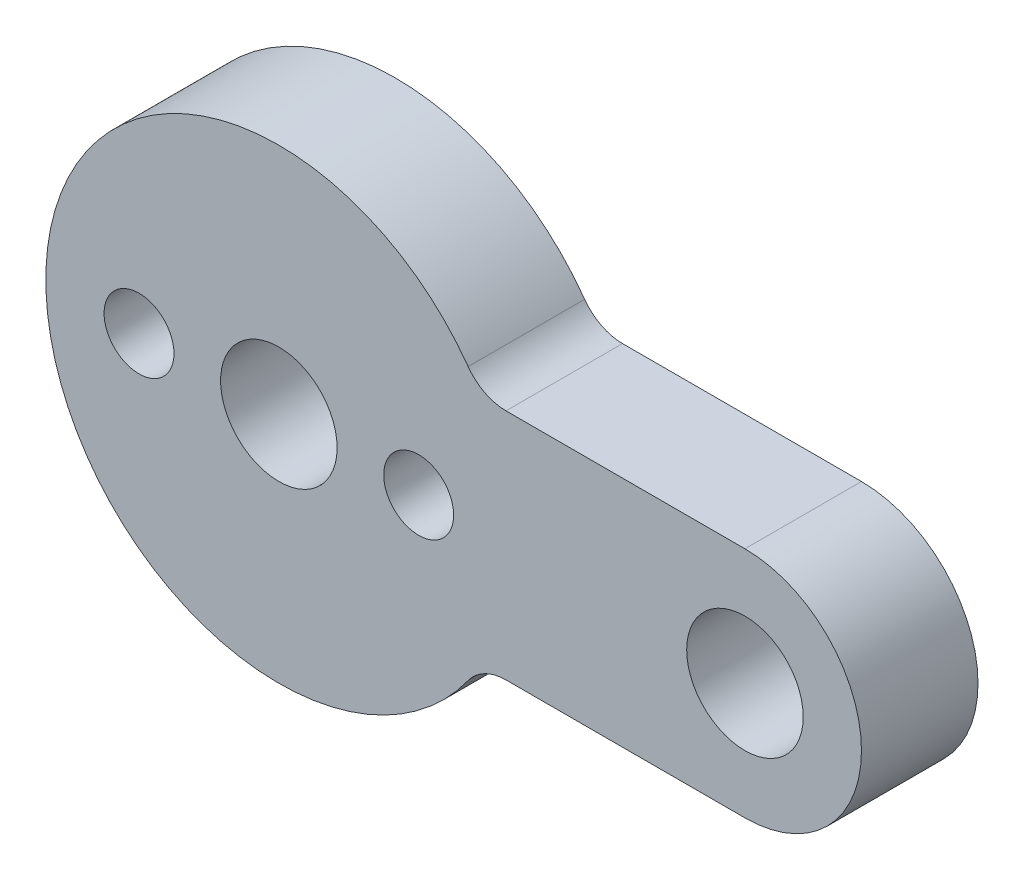
from build123d import *
from build123d.topology import SkipClean

# Parameters (mm, degrees)
SKETCH_1_R               = 2.4999999999999982
SKETCH_1_R_2             = 2.4999999999999947
SKETCH_1_R_3             = 2.5
EXTRUDE_1_DEPTH          = 5
EXTRUDE_START            = 12.8
SKETCH_2_R               = 5.000000000000004
SKETCH_2_R_2             = 2.4999999999999947
SKETCH_2_R_3             = 5
SKETCH_2_R_4             = 2.5
EXTRUDE_2_DEPTH          = 12.8
SKETCH_3_R               = 1.5000000000000007
CUT_EXTRUDE_1_DEPTH      = 13
EXTRUDE_START_2          = -5
EXTRUDE_3_DEPTH          = 5
FILLET_1_R               = 2
CUT_EXTRUDE_2_DEPTH      = 16
CUT_EXTRUDE_2_DEPTH_BACK = 10
CUT_EXTRUDE_START        = 14.000000000000002
SKETCH_7_R               = 5
CUT_EXTRUDE_3_DEPTH      = 14.000000000000002


with BuildPart() as part:
    # 草图1 → 凸台-拉伸1 (new body)
    with BuildSketch(Plane.XY):
        with BuildLine():
            Line((6.1e-16, -5), (-40, -5.000000000000006))
            ThreePointArc((-40, -5.000000000000006), (-45, -4.29e-15), (-40, 4.999999999999996))
            Line((-40, 4.999999999999996), (-6.1e-16, 5))
            ThreePointArc((-6.1e-16, 5), (5, 0), (6.1e-16, -5))
        make_face()
        with Locations((-20, -2.45e-15)):
            Circle(SKETCH_1_R, mode=Mode.SUBTRACT)
        with Locations((-40, -4.9e-15)):
            Circle(SKETCH_1_R_2, mode=Mode.SUBTRACT)
        Circle(SKETCH_1_R_3, mode=Mode.SUBTRACT)
    extrude(amount=EXTRUDE_1_DEPTH)

    # 草图2 → 凸台-拉伸2 (add)
    # profile 1 of 2: a face of its own
    with SkipClean():  # the faces are left unmerged after this step: merging them gives an invalid solid
        with BuildSketch(Plane(origin=(0, 0, 0), x_dir=(-1, 0, 0), z_dir=(0, 0, -1)).offset(EXTRUDE_START)):
            with Locations((40, -4.9e-15)):
                Circle(SKETCH_2_R)
            with Locations((40, -4.9e-15)):
                Circle(SKETCH_2_R_2, mode=Mode.SUBTRACT)
        # profile 2 of 2: a face of its own
        with BuildSketch(Plane(origin=(0, 0, 0), x_dir=(-1, 0, 0), z_dir=(0, 0, -1)).offset(EXTRUDE_START)):
            Circle(SKETCH_2_R_3)
            Circle(SKETCH_2_R_4, mode=Mode.SUBTRACT)
        extrude(amount=-EXTRUDE_2_DEPTH)

    # 草图3 → 切除-拉伸1 (cut)
    with SkipClean():  # the faces are left unmerged after this step: merging them gives an invalid solid
        with BuildSketch(Plane.XY.offset(5)):
            with Locations((-26.000000000000004, -2.45e-15)):
                Circle(SKETCH_3_R)
            with Locations((-13.999999999999998, -2.4e-16)):
                Circle(SKETCH_3_R)
        extrude(amount=-CUT_EXTRUDE_1_DEPTH, mode=Mode.SUBTRACT)

    # 草图4 → 凸台-拉伸3 (add)
    with SkipClean():  # the faces are left unmerged after this step: merging them gives an invalid solid
        with BuildSketch(Plane.XY.offset(5).offset(EXTRUDE_START_2)):
            with BuildLine():
                Line((-29.484888992731253, 3.168103659220378), (-10.515111007268752, 3.168103659220378))
                ThreePointArc((-10.515111007268752, 3.168103659220378), (-20, 9.999999999999996), (-29.484888992731253, 3.168103659220378))
            make_face()
            with BuildLine():
                Line((-29.548830353481478, -2.969821354969149), (-10.451169646518524, -2.969821354969149))
                ThreePointArc((-10.451169646518524, -2.969821354969149), (-20, -10), (-29.548830353481478, -2.969821354969149))
            make_face()
        extrude(amount=EXTRUDE_3_DEPTH)

    # 圆角1
    fillet_1_edges = [part.edges().sort_by_distance(p)[0] for p in [
        (-11.339745962155616, -5.000000000000002, 2.5),
        (-28.660254037844382, -5.000000000000005, 2.5),
        (-28.660254037844386, 4.999999999999997, 2.5),
        (-11.339745962155614, 4.999999999999999, 2.5),
    ]]
    fillet(fillet_1_edges, radius=FILLET_1_R)

    # 草图6 → 切除-拉伸2 (cut, two sides: drawn at the far end of the back side and taken through both)
    with SkipClean():  # the faces are left unmerged after this step: merging them gives an invalid solid
        with BuildSketch(Plane(origin=(0, 0, 0), x_dir=(-1, 0, 0), z_dir=(0, 0, -1)).offset(-CUT_EXTRUDE_2_DEPTH_BACK)):
            with BuildLine():
                Line((28.122328620674136, 5.83333333333333), (47.018648457175516, 5.83333333333333))
                Line((47.018648457175516, 5.83333333333333), (47.018648457175516, -5.833333333333338))
                Line((47.018648457175516, -5.833333333333338), (28.122328620674132, -5.833333333333338))
                ThreePointArc((28.122328620674132, -5.833333333333338), (30, -4.67e-15), (28.122328620674136, 5.83333333333333))
            make_face()
        extrude(amount=CUT_EXTRUDE_2_DEPTH + CUT_EXTRUDE_2_DEPTH_BACK, mode=Mode.SUBTRACT)

    # 草图7 → 切除-拉伸3 (cut)
    with SkipClean():  # the faces are left unmerged after this step: merging them gives an invalid solid
        with BuildSketch(Plane(origin=(0, 0, 0), x_dir=(-1, 0, 0), z_dir=(0, 0, -1)).offset(CUT_EXTRUDE_START)):
            Circle(SKETCH_7_R)
        extrude(amount=-CUT_EXTRUDE_3_DEPTH, mode=Mode.SUBTRACT)


solid = part.part
